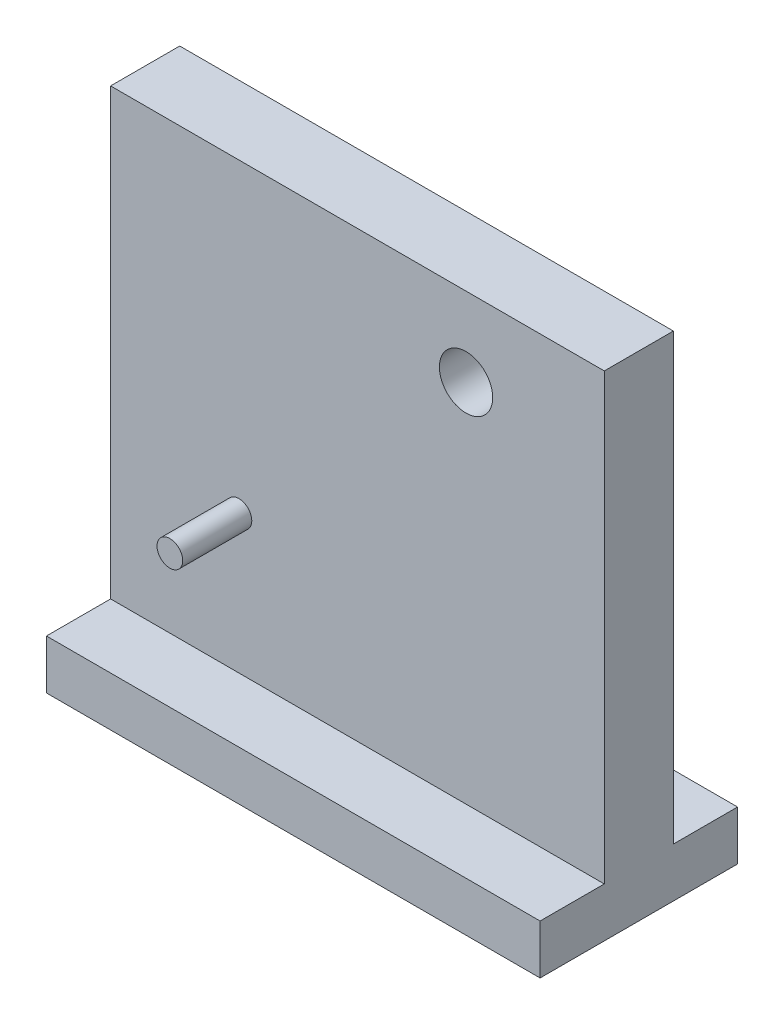
from build123d import *

# Parameters (mm, degrees)
SKETCH_1_W      = 40
SKETCH_1_H      = 50
SKETCH_1_R      = 2.7
EXTRUDE_1_DEPTH = 3.5
SKETCH_3_W      = 40
SKETCH_3_H      = 5
EXTRUDE_2_DEPTH = 10
EXTRUDE_3_DEPTH = 10
SKETCH_5_R      = 1.3
EXTRUDE_4_DEPTH = 7


with BuildPart() as part:
    # 草图1 → 凸台-拉伸1 (new, symmetric)
    with BuildSketch(Plane.XY):
        with Locations((0, 25)):
            Rectangle(SKETCH_1_W, SKETCH_1_H)
        with Locations((6, 42)):
            Circle(SKETCH_1_R, mode=Mode.SUBTRACT)
    extrude(amount=EXTRUDE_1_DEPTH, both=True)

    # 草图3 → 凸台-拉伸2 (add, symmetric)
    with BuildSketch(Plane.XY):
        with Locations((0, 2.5)):
            Rectangle(SKETCH_3_W, SKETCH_3_H)
    extrude(amount=EXTRUDE_2_DEPTH, both=True)

    # 草图7 → 凸台-拉伸3 (add)
    with BuildSketch(Plane.ZY.offset(20)):
        Polygon((-10, 0), (10, 0), (10, 5), (3.5, 5), (3.5, 50), (-3.5, 50), (-3.5, 5), (-10, 5), align=None)
    extrude(amount=EXTRUDE_3_DEPTH)

    # 草图5 → 凸台-拉伸4 (add)
    with BuildSketch(Plane.XY.offset(3.5)):
        with Locations((-17, 19)):
            Circle(SKETCH_5_R)
    extrude(amount=EXTRUDE_4_DEPTH)


solid = part.part
